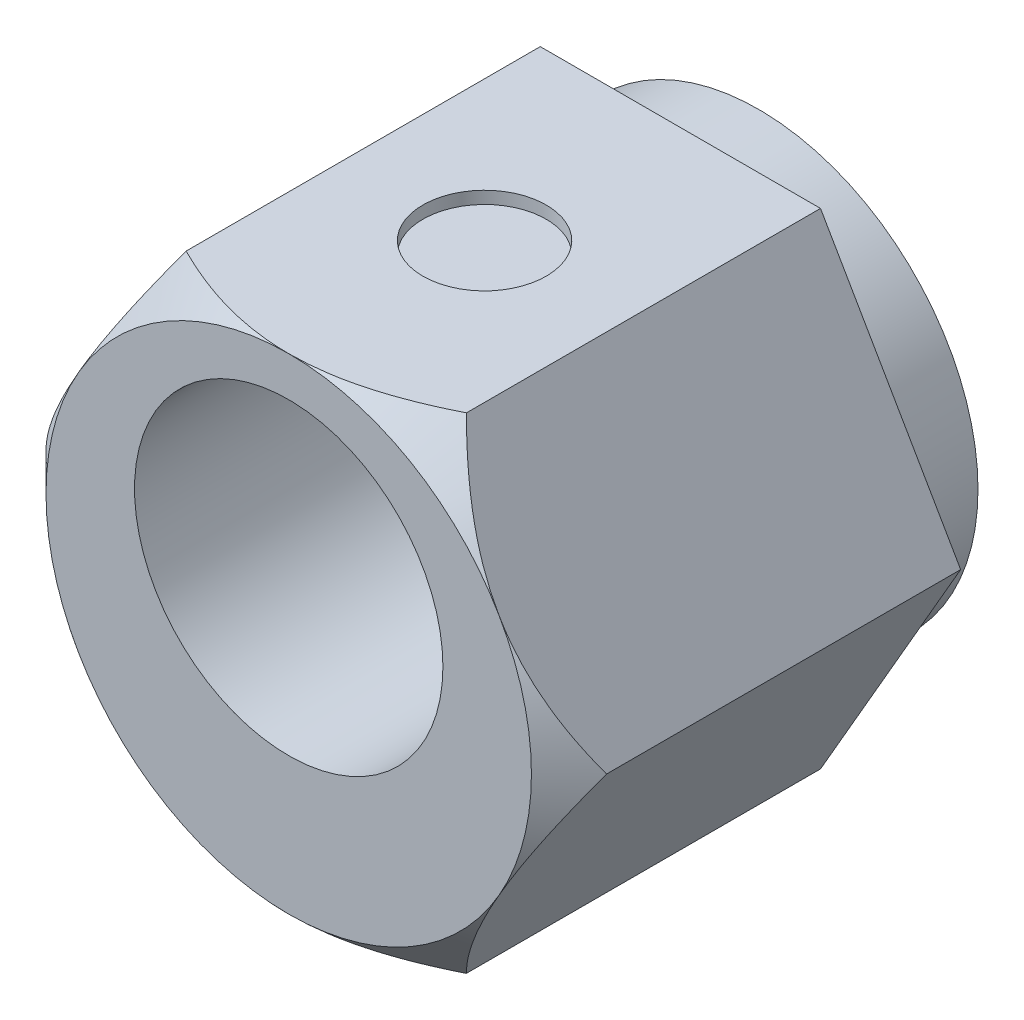
from build123d import *

# Parameters (mm, degrees)
ESQUISSE1_R             = 3.555
BOSS_EXTRU_1_DEPTH      = 1.27
BOSS_EXTRU_2_DEPTH      = 6.35
ESQUISSE3_R             = 2.5
ENL_V_MAT_EXTRU_1_DEPTH = 10.705372653
ESQUISSE4_R             = 1
ENL_V_MAT_EXTRU_2_DEPTH = 0.2


with BuildPart() as part:
    # Esquisse1 → Boss.-Extru.1 (new body)
    with BuildSketch(Plane.XY):
        Circle(ESQUISSE1_R)
    extrude(amount=-BOSS_EXTRU_1_DEPTH)

    # Esquisse2 → Boss.-Extru.2 (add)
    with BuildSketch(Plane.XY):
        Polygon((4.543746619, 0), (2.271873309, 3.935), (-2.271873309, 3.935), (-4.543746619, 0), (-2.271873309, -3.935), (2.271873309, -3.935), align=None)
    extrude(amount=BOSS_EXTRU_2_DEPTH)

    # Esquisse3 → Enlèv. mat.-Extru.1 (cut, through all)
    with BuildSketch(Plane.XY.offset(6.35)):
        with Locations((0, 0.79)):
            Circle(ESQUISSE3_R)
    extrude(amount=-ENL_V_MAT_EXTRU_1_DEPTH, mode=Mode.SUBTRACT)

    # Esquisse4 → Enlèv. mat.-Extru.2 (cut)
    with BuildSketch(Plane(origin=(0, 3.935, 0), x_dir=(1, 0, 0), z_dir=(0, 1, 0))):
        with Locations(Location((0, -3.175, 0), (0, 0, 270))):
            Circle(ESQUISSE4_R)
    extrude(amount=-ENL_V_MAT_EXTRU_2_DEPTH, mode=Mode.SUBTRACT)

    # Esquisse5 → Enlèvement de matière-Révolution1 (revolve, cut)
    with BuildSketch(Plane(origin=(0, 0, 0), x_dir=(-0.8660254037844386, -0.5000000000000001, 0), z_dir=(-0.5000000000000001, 0.8660254037844386, 0))):
        Polygon((-3.935, 6.35), (-10.285, 0), (-10.285, 6.35), align=None)
    revolve(axis=Axis((0, 0, 0), (0, 0, 1)), mode=Mode.SUBTRACT)


solid = part.part
